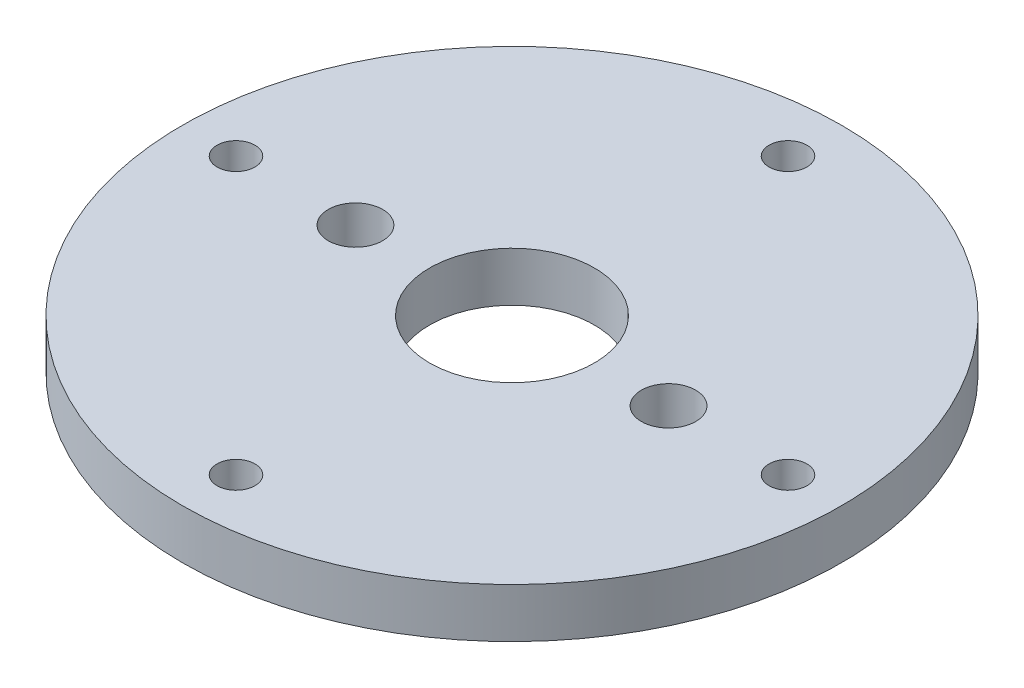
from build123d import *

# Parameters (mm, degrees)
SKETCH_1_R          = 20
EXTRUDE_1_DEPTH     = 3
CUT_EXTRUDE_1_REACH = 30.443
SKETCH_2_R          = 1.15
CUT_EXTRUDE_2_REACH = 30.443
SKETCH_3_R          = 1.65
SKETCH_3_R_2        = 5


with BuildPart() as part:
    # 草图1 → 凸台-拉伸1 (new body)
    with BuildSketch(Plane(origin=(0, 0, 0), x_dir=(1, 0, 0), z_dir=(0, 1, 0))):
        with Locations(Location((0, 0, 0), (0, 0, 270))):
            Circle(SKETCH_1_R)
    extrude(amount=EXTRUDE_1_DEPTH)

    # 草图2 → 切除-拉伸1 (cut, up to next)
    with BuildSketch(Plane(origin=(0, 3, 0), x_dir=(1, 0, 0), z_dir=(0, 1, 0)), mode=Mode.PRIVATE) as cut_extrude_1_sk1:
        with Locations(Location((0, 16.75, 0), (0, 0, 270))):
            Circle(SKETCH_2_R)
    cut_extrude_1_tool1 = extrude(cut_extrude_1_sk1.sketch, amount=-CUT_EXTRUDE_1_REACH, mode=Mode.PRIVATE) & part.part
    # 草图2 → 切除-拉伸1 (cut, up to next)
    with BuildSketch(Plane(origin=(0, 3, 0), x_dir=(1, 0, 0), z_dir=(0, 1, 0)), mode=Mode.PRIVATE) as cut_extrude_1_sk2:
        with Locations(Location((16.75, 0, 0), (0, 0, 270))):
            Circle(SKETCH_2_R)
    cut_extrude_1_tool2 = extrude(cut_extrude_1_sk2.sketch, amount=-CUT_EXTRUDE_1_REACH, mode=Mode.PRIVATE) & part.part
    # 草图2 → 切除-拉伸1 (cut, up to next)
    with BuildSketch(Plane(origin=(0, 3, 0), x_dir=(1, 0, 0), z_dir=(0, 1, 0)), mode=Mode.PRIVATE) as cut_extrude_1_sk3:
        with Locations(Location((0, -16.75, 0), (0, 0, 270))):
            Circle(SKETCH_2_R)
    cut_extrude_1_tool3 = extrude(cut_extrude_1_sk3.sketch, amount=-CUT_EXTRUDE_1_REACH, mode=Mode.PRIVATE) & part.part
    # 草图2 → 切除-拉伸1 (cut, up to next)
    with BuildSketch(Plane(origin=(0, 3, 0), x_dir=(1, 0, 0), z_dir=(0, 1, 0)), mode=Mode.PRIVATE) as cut_extrude_1_sk4:
        with Locations(Location((-16.75, 0, 0), (0, 0, 270))):
            Circle(SKETCH_2_R)
    cut_extrude_1_tool4 = extrude(cut_extrude_1_sk4.sketch, amount=-CUT_EXTRUDE_1_REACH, mode=Mode.PRIVATE) & part.part
    add(cut_extrude_1_tool1.solids().sort_by_distance((0, 3, -16.75))[0], mode=Mode.SUBTRACT)
    add(cut_extrude_1_tool2.solids().sort_by_distance((16.75, 3, 0))[0], mode=Mode.SUBTRACT)
    add(cut_extrude_1_tool3.solids().sort_by_distance((0, 3, 16.75))[0], mode=Mode.SUBTRACT)
    add(cut_extrude_1_tool4.solids().sort_by_distance((-16.75, 3, 0))[0], mode=Mode.SUBTRACT)

    # 草图3 → 切除-拉伸2 (cut, up to next)
    with BuildSketch(Plane(origin=(0, 3, 0), x_dir=(1, 0, 0), z_dir=(0, 1, 0)), mode=Mode.PRIVATE) as cut_extrude_2_sk1:
        with Locations(Location((-9.5, 0, 0), (0, 0, 270))):
            Circle(SKETCH_3_R)
    cut_extrude_2_tool1 = extrude(cut_extrude_2_sk1.sketch, amount=-CUT_EXTRUDE_2_REACH, mode=Mode.PRIVATE) & part.part
    # 草图3 → 切除-拉伸2 (cut, up to next)
    with BuildSketch(Plane(origin=(0, 3, 0), x_dir=(1, 0, 0), z_dir=(0, 1, 0)), mode=Mode.PRIVATE) as cut_extrude_2_sk2:
        with Locations(Location((9.5, 0, 0), (0, 0, 270))):
            Circle(SKETCH_3_R)
    cut_extrude_2_tool2 = extrude(cut_extrude_2_sk2.sketch, amount=-CUT_EXTRUDE_2_REACH, mode=Mode.PRIVATE) & part.part
    # 草图3 → 切除-拉伸2 (cut, up to next)
    with BuildSketch(Plane(origin=(0, 3, 0), x_dir=(1, 0, 0), z_dir=(0, 1, 0)), mode=Mode.PRIVATE) as cut_extrude_2_sk3:
        with Locations(Location((0, 0, 0), (0, 0, 270))):
            Circle(SKETCH_3_R_2)
    cut_extrude_2_tool3 = extrude(cut_extrude_2_sk3.sketch, amount=-CUT_EXTRUDE_2_REACH, mode=Mode.PRIVATE) & part.part
    add(cut_extrude_2_tool1.solids().sort_by_distance((-9.5, 3, 0))[0], mode=Mode.SUBTRACT)
    add(cut_extrude_2_tool2.solids().sort_by_distance((9.5, 3, 0))[0], mode=Mode.SUBTRACT)
    add(cut_extrude_2_tool3.solids().sort_by_distance((0, 3, 0))[0], mode=Mode.SUBTRACT)


solid = part.part
